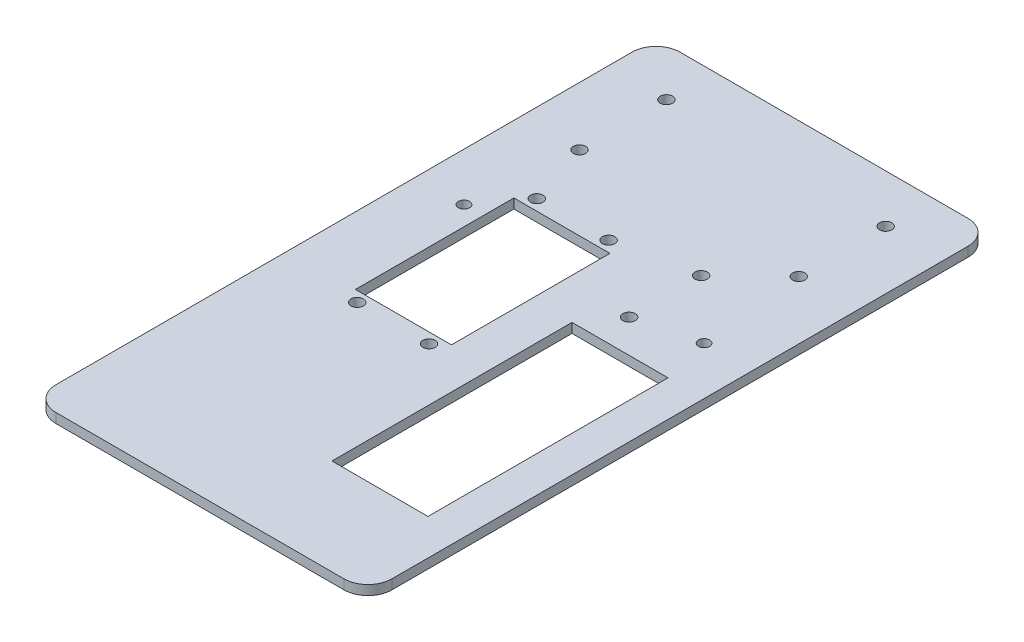
from build123d import *

# Parameters (mm, degrees)
SKETCH1_R             = 1.4732
BOSS_EXTRUDE1_DEPTH   = 2.54
F_4_CLEARANCE_HOLE1_D = 3.2639
CUT_EXTRUDE1_REACH    = 95.791
SKETCH4_W             = 25.4
SKETCH4_H             = 63.5
SKETCH4_H_2           = 41.91


with BuildPart() as part:
    # Sketch1 → Boss-Extrude1 (new body)
    with BuildSketch(Plane(origin=(0, 0, 0), x_dir=(1, 0, 0), z_dir=(0, 1, 0))):
        with BuildLine():
            ThreePointArc((-44.45, 76.2), (-42.590128061, 80.690128061), (-38.1, 82.55))
            Line((-38.1, 82.55), (38.1, 82.55))
            ThreePointArc((38.1, 82.55), (42.590128061, 80.690128061), (44.45, 76.2))
            Line((44.45, 76.2), (44.45, -76.2))
            ThreePointArc((44.45, -76.2), (42.590128061, -80.690128061), (38.1, -82.55))
            Line((38.1, -82.55), (-38.1, -82.55))
            ThreePointArc((-38.1, -82.55), (-42.590128061, -80.690128061), (-44.45, -76.2))
            Line((-44.45, -76.2), (-44.45, 76.2))
        make_face()
        with Locations(Location((31.75, 19.05, 0), (0, 0, 270))):
            Circle(SKETCH1_R, mode=Mode.SUBTRACT)
        with Locations(Location((-31.75, 19.05, 0), (0, 0, 270))):
            Circle(SKETCH1_R, mode=Mode.SUBTRACT)
    extrude(amount=BOSS_EXTRUDE1_DEPTH)

    # #4 Clearance Hole1 (through all)
    with Locations(Plane(origin=(-29, 2.54, -69.85), x_dir=(0, 0, 1), z_dir=(0, 1, 0))):
        with Locations((0, 0), (0, 58), (23, 58), (23, 0), (39.8275, 5.53), (39.8275, 24.53), (87.3275, 24.53), (87.3275, 5.53), (35.7, 44.875), (54.75, 44.875)):
            Hole(F_4_CLEARANCE_HOLE1_D / 2)

    # Sketch4 → Cut-Extrude1 (cut, up to next)
    with BuildSketch(Plane(origin=(0, 2.54, 0), x_dir=(1, 0, 0), z_dir=(0, 1, 0)), mode=Mode.PRIVATE) as cut_extrude1_sk1:
        with Locations((22.225, -25.4)):
            Rectangle(SKETCH4_W, SKETCH4_H)
    cut_extrude1_tool1 = extrude(cut_extrude1_sk1.sketch, amount=-CUT_EXTRUDE1_REACH, mode=Mode.PRIVATE) & part.part
    # Sketch4 → Cut-Extrude1 (cut, up to next)
    with BuildSketch(Plane(origin=(0, 2.54, 0), x_dir=(1, 0, 0), z_dir=(0, 1, 0)), mode=Mode.PRIVATE) as cut_extrude1_sk2:
        with Locations((-13.97, 6.21)):
            Rectangle(SKETCH4_W, SKETCH4_H_2)
    cut_extrude1_tool2 = extrude(cut_extrude1_sk2.sketch, amount=-CUT_EXTRUDE1_REACH, mode=Mode.PRIVATE) & part.part
    add(cut_extrude1_tool1.solids().sort_by_distance((22.225, 2.54, 25.4))[0], mode=Mode.SUBTRACT)
    add(cut_extrude1_tool2.solids().sort_by_distance((-13.97, 2.54, -6.21))[0], mode=Mode.SUBTRACT)


solid = part.part
